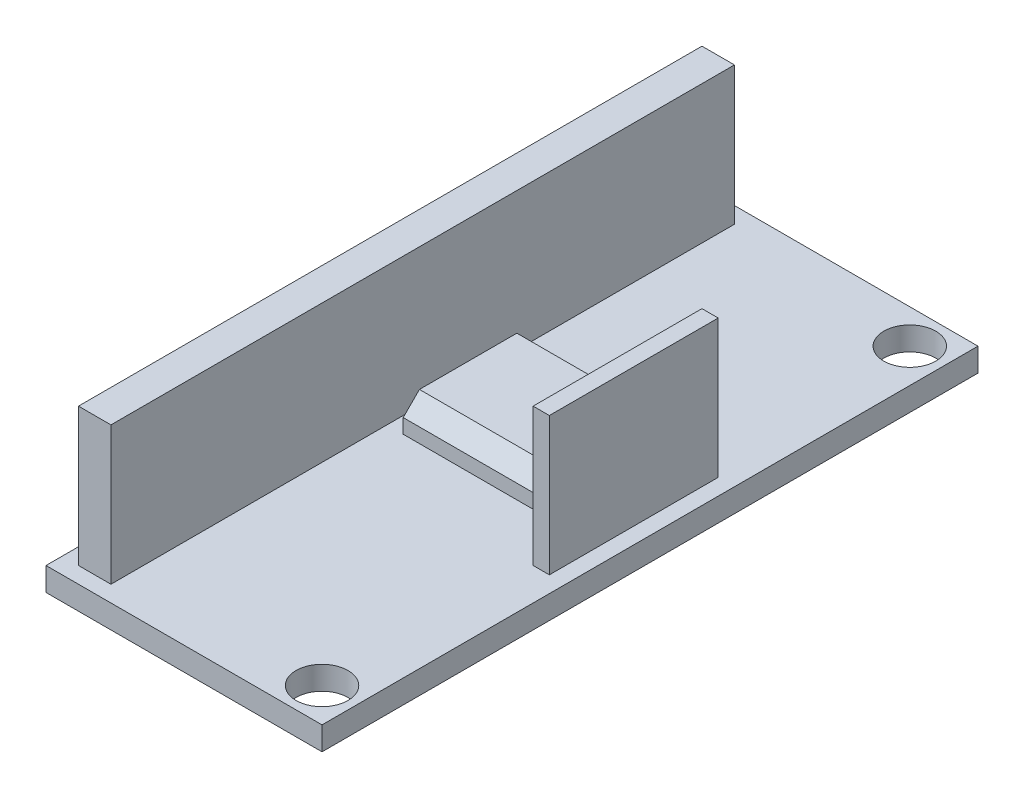
from build123d import *

# Parameters (mm, degrees)
SKETCH1_W           = 17
SKETCH1_H           = 40.4
BOSS_EXTRUDE1_DEPTH = 1.44
SKETCH2_R           = 1.6
CUT_EXTRUDE1_DEPTH  = 1.44
SKETCH3_W           = 10
SKETCH3_H           = 8
BOSS_EXTRUDE2_DEPTH = 1.89
CHAMFER1_SIZE       = 1
SKETCH4_W           = 2
SKETCH4_H           = 38.4
SKETCH4_W_2         = 1
SKETCH4_H_2         = 10.4
BOSS_EXTRUDE3_DEPTH = 8.5


with BuildPart() as part:
    # Sketch1 → Boss-Extrude1 (new body)
    with BuildSketch(Plane(origin=(0, 0, 0), x_dir=(1, 0, 0), z_dir=(0, 1, 0))):
        with Locations((8.5, 20.2)):
            Rectangle(SKETCH1_W, SKETCH1_H)
    extrude(amount=BOSS_EXTRUDE1_DEPTH)

    # Sketch2 → Cut-Extrude1 (cut)
    with BuildSketch(Plane(origin=(0, 1.44, 0), x_dir=(1, 0, 0), z_dir=(0, 1, 0))):
        with Locations(Location((14.9, 38.3, 0), (0, 0, 270))):
            Circle(SKETCH2_R)
        with Locations(Location((14.9, 2.1, 0), (0, 0, 270))):
            Circle(SKETCH2_R)
    extrude(amount=-CUT_EXTRUDE1_DEPTH, mode=Mode.SUBTRACT)

    # Sketch3 → Boss-Extrude2 (add)
    with BuildSketch(Plane(origin=(0, 1.44, 0), x_dir=(1, 0, 0), z_dir=(0, 1, 0))):
        with Locations((9, 22)):
            Rectangle(SKETCH3_W, SKETCH3_H)
    extrude(amount=BOSS_EXTRUDE2_DEPTH)

    # Chamfer1
    chamfer1_edges = [part.edges().sort_by_distance(p)[0] for p in [
        (9, 3.33, -18),
        (9, 3.33, -26),
    ]]
    chamfer(chamfer1_edges, length=CHAMFER1_SIZE)

    # Sketch4 → Boss-Extrude3 (add)
    with BuildSketch(Plane(origin=(0, 1.44, 0), x_dir=(1, 0, 0), z_dir=(0, 1, 0))):
        with Locations((2, 20.2)):
            Rectangle(SKETCH4_W, SKETCH4_H)
        with Locations((15.5, 20.2)):
            Rectangle(SKETCH4_W_2, SKETCH4_H_2)
    extrude(amount=BOSS_EXTRUDE3_DEPTH)


solid = part.part
